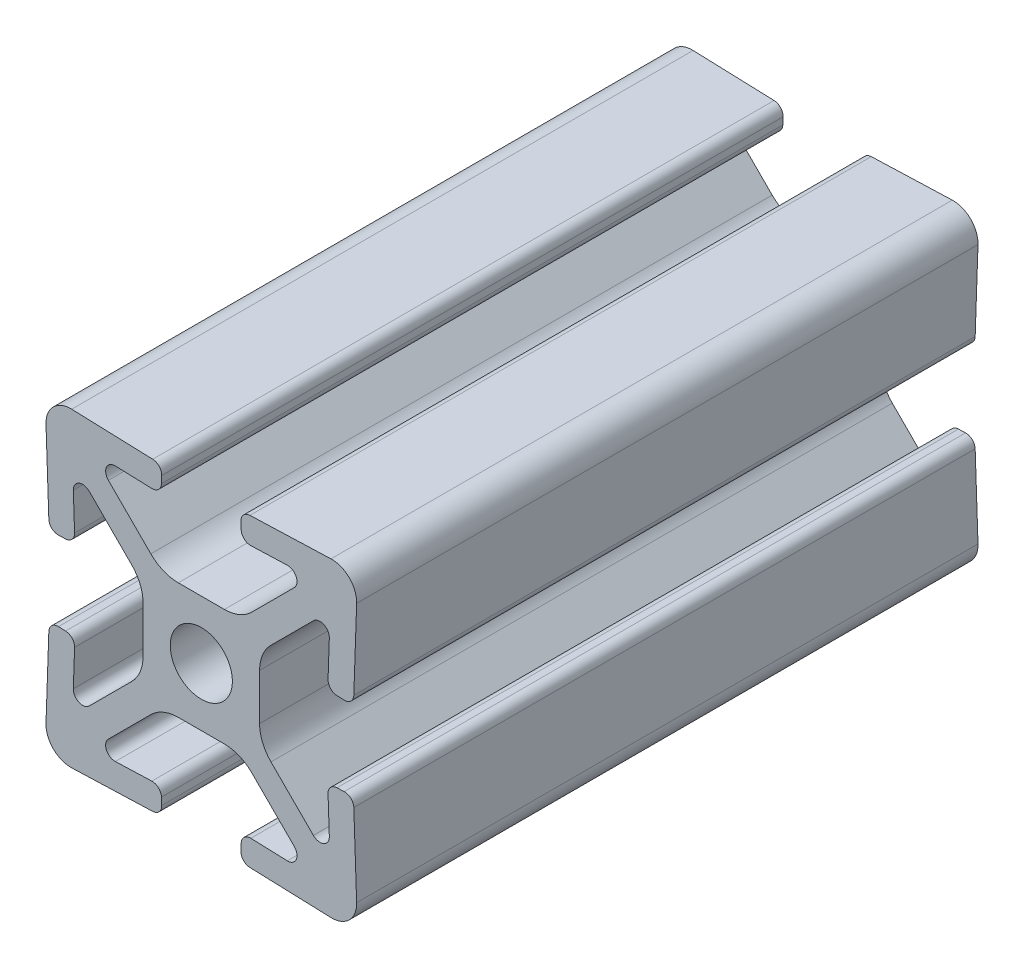
from build123d import *

# Parameters (mm, degrees)
BOSS_EXTRUDE1_DEPTH = 609.6
CIRPATTERN1_COUNT   = 4
CUT_EXTRUDE1_DEPTH  = 1168.4


with BuildPart() as part:
    # Sketch3 → Boss-Extrude1 (new, symmetric)
    with BuildSketch(Plane.XY):
        with BuildLine():
            Line((0, 4.7625), (-1.884807374, 4.7625))
            ThreePointArc((-1.884807374, 4.7625), (-3.099827272, 5.004182484), (-4.129871405, 5.69243597))
            Line((-4.129871405, 5.69243597), (-7.599623114, 9.162187679))
            ThreePointArc((-7.599623114, 9.162187679), (-7.759888701, 10.006330839), (-7.033220609, 10.464824259))
            Line((-7.033220609, 10.464824259), (-4.047481702, 10.360559959))
            ThreePointArc((-4.047481702, 10.360559959), (-3.501205536, 10.564804249), (-3.259352476, 11.095502353))
            Line((-3.259352476, 11.095502353), (-3.23896419, 11.679346474))
            ThreePointArc((-3.23896419, 11.679346474), (-3.443208479, 12.225622641), (-3.973906584, 12.467475701))
            Line((-3.973906584, 12.467475701), (-10.597084223, 12.698762161))
            ThreePointArc((-10.597084223, 12.698762161), (-12.104840979, 12.104840979), (-12.698762161, 10.597084223))
            Line((-12.698762161, 10.597084223), (-12.467475701, 3.973906584))
            ThreePointArc((-12.467475701, 3.973906584), (-12.225622641, 3.443208479), (-11.679346474, 3.23896419))
            Line((-11.679346474, 3.23896419), (-11.095502353, 3.259352476))
            ThreePointArc((-11.095502353, 3.259352476), (-10.564804249, 3.501205536), (-10.360559959, 4.047481702))
            Line((-10.360559959, 4.047481702), (-10.464824259, 7.033220609))
            ThreePointArc((-10.464824259, 7.033220609), (-10.006330839, 7.759888701), (-9.162187679, 7.599623114))
            Line((-9.162187679, 7.599623114), (-5.69243597, 4.129871405))
            ThreePointArc((-5.69243597, 4.129871405), (-5.004182484, 3.099827272), (-4.7625, 1.884807374))
            Line((-4.7625, 1.884807374), (-4.7625, 0))
            Line((-4.7625, 0), (-2.54, 0))
            ThreePointArc((-2.54, 0), (-1.796051224, 1.796051224), (0, 2.54))
            Line((0, 2.54), (0, 4.7625))
        make_face()
    boss_extrude1 = extrude(amount=BOSS_EXTRUDE1_DEPTH, both=True)

    # CirPattern1: Boss-Extrude1 ×4 about axis
    cirpattern1_axis = Axis((0, 0, 0), (0, 0, 1))
    for i in range(1, CIRPATTERN1_COUNT):
        add(boss_extrude1.rotate(cirpattern1_axis, i * 360 / CIRPATTERN1_COUNT))

    # Sketch4 → Cut-Extrude1 (cut)
    with BuildSketch(Plane.XY.offset(609.6)):
        with BuildLine():
            Line((1.884807374, 4.7625), (-1.884807374, 4.7625))
            ThreePointArc((-1.884807374, 4.7625), (-3.099827272, 5.004182484), (-4.129871405, 5.69243597))
            Line((-4.129871405, 5.69243597), (-7.599623114, 9.162187679))
            ThreePointArc((-7.599623114, 9.162187679), (-7.759888701, 10.006330839), (-7.033220609, 10.464824259))
            Line((-7.033220609, 10.464824259), (-4.047481702, 10.360559959))
            ThreePointArc((-4.047481702, 10.360559959), (-3.501205536, 10.564804249), (-3.259352476, 11.095502353))
            Line((-3.259352476, 11.095502353), (-3.23896419, 11.679346474))
            ThreePointArc((-3.23896419, 11.679346474), (-3.443208479, 12.225622641), (-3.973906584, 12.467475701))
            Line((-3.973906584, 12.467475701), (-10.597084223, 12.698762161))
            ThreePointArc((-10.597084223, 12.698762161), (-12.104840979, 12.104840979), (-12.698762161, 10.597084223))
            Line((-12.698762161, 10.597084223), (-12.467475701, 3.973906584))
            ThreePointArc((-12.467475701, 3.973906584), (-12.225622641, 3.443208479), (-11.679346474, 3.23896419))
            Line((-11.679346474, 3.23896419), (-11.095502353, 3.259352476))
            ThreePointArc((-11.095502353, 3.259352476), (-10.564804249, 3.501205536), (-10.360559959, 4.047481702))
            Line((-10.360559959, 4.047481702), (-10.464824259, 7.033220609))
            ThreePointArc((-10.464824259, 7.033220609), (-10.006330839, 7.759888701), (-9.162187679, 7.599623114))
            Line((-9.162187679, 7.599623114), (-5.69243597, 4.129871405))
            ThreePointArc((-5.69243597, 4.129871405), (-5.004182484, 3.099827272), (-4.7625, 1.884807374))
            Line((-4.7625, 1.884807374), (-4.7625, -1.884807374))
            ThreePointArc((-4.7625, -1.884807374), (-5.004182484, -3.099827272), (-5.69243597, -4.129871405))
            Line((-5.69243597, -4.129871405), (-9.162187679, -7.599623114))
            ThreePointArc((-9.162187679, -7.599623114), (-10.006330839, -7.759888701), (-10.464824259, -7.033220609))
            Line((-10.464824259, -7.033220609), (-10.360559959, -4.047481702))
            ThreePointArc((-10.360559959, -4.047481702), (-10.564804249, -3.501205536), (-11.095502353, -3.259352476))
            Line((-11.095502353, -3.259352476), (-11.679346474, -3.23896419))
            ThreePointArc((-11.679346474, -3.23896419), (-12.225622641, -3.443208479), (-12.467475701, -3.973906584))
            Line((-12.467475701, -3.973906584), (-12.698762161, -10.597084223))
            ThreePointArc((-12.698762161, -10.597084223), (-12.104840979, -12.104840979), (-10.597084223, -12.698762161))
            Line((-10.597084223, -12.698762161), (-3.973906584, -12.467475701))
            ThreePointArc((-3.973906584, -12.467475701), (-3.443208479, -12.225622641), (-3.23896419, -11.679346474))
            Line((-3.23896419, -11.679346474), (-3.259352476, -11.095502353))
            ThreePointArc((-3.259352476, -11.095502353), (-3.501205536, -10.564804249), (-4.047481702, -10.360559959))
            Line((-4.047481702, -10.360559959), (-7.033220609, -10.464824259))
            ThreePointArc((-7.033220609, -10.464824259), (-7.759888701, -10.006330839), (-7.599623114, -9.162187679))
            Line((-7.599623114, -9.162187679), (-4.129871405, -5.69243597))
            ThreePointArc((-4.129871405, -5.69243597), (-3.099827272, -5.004182484), (-1.884807374, -4.7625))
            Line((-1.884807374, -4.7625), (1.884807374, -4.7625))
            ThreePointArc((1.884807374, -4.7625), (3.099827272, -5.004182484), (4.129871405, -5.69243597))
            Line((4.129871405, -5.69243597), (7.599623114, -9.162187679))
            ThreePointArc((7.599623114, -9.162187679), (7.759888701, -10.006330839), (7.033220609, -10.464824259))
            Line((7.033220609, -10.464824259), (4.047481702, -10.360559959))
            ThreePointArc((4.047481702, -10.360559959), (3.501205536, -10.564804249), (3.259352476, -11.095502353))
            Line((3.259352476, -11.095502353), (3.23896419, -11.679346474))
            ThreePointArc((3.23896419, -11.679346474), (3.443208479, -12.225622641), (3.973906584, -12.467475701))
            Line((3.973906584, -12.467475701), (10.597084223, -12.698762161))
            ThreePointArc((10.597084223, -12.698762161), (12.104840979, -12.104840979), (12.698762161, -10.597084223))
            Line((12.698762161, -10.597084223), (12.467475701, -3.973906584))
            ThreePointArc((12.467475701, -3.973906584), (12.225622641, -3.443208479), (11.679346474, -3.23896419))
            Line((11.679346474, -3.23896419), (11.095502353, -3.259352476))
            ThreePointArc((11.095502353, -3.259352476), (10.564804249, -3.501205536), (10.360559959, -4.047481702))
            Line((10.360559959, -4.047481702), (10.464824259, -7.033220609))
            ThreePointArc((10.464824259, -7.033220609), (10.006330839, -7.759888701), (9.162187679, -7.599623114))
            Line((9.162187679, -7.599623114), (5.69243597, -4.129871405))
            ThreePointArc((5.69243597, -4.129871405), (5.004182484, -3.099827272), (4.7625, -1.884807374))
            Line((4.7625, -1.884807374), (4.7625, 1.884807374))
            ThreePointArc((4.7625, 1.884807374), (5.004182484, 3.099827272), (5.69243597, 4.129871405))
            Line((5.69243597, 4.129871405), (9.162187679, 7.599623114))
            ThreePointArc((9.162187679, 7.599623114), (10.006330839, 7.759888701), (10.464824259, 7.033220609))
            Line((10.464824259, 7.033220609), (10.360559959, 4.047481702))
            ThreePointArc((10.360559959, 4.047481702), (10.564804249, 3.501205536), (11.095502353, 3.259352476))
            Line((11.095502353, 3.259352476), (11.679346474, 3.23896419))
            ThreePointArc((11.679346474, 3.23896419), (12.225622641, 3.443208479), (12.467475701, 3.973906584))
            Line((12.467475701, 3.973906584), (12.698762161, 10.597084223))
            ThreePointArc((12.698762161, 10.597084223), (12.104840979, 12.104840979), (10.597084223, 12.698762161))
            Line((10.597084223, 12.698762161), (3.973906584, 12.467475701))
            ThreePointArc((3.973906584, 12.467475701), (3.443208479, 12.225622641), (3.23896419, 11.679346474))
            Line((3.23896419, 11.679346474), (3.259352476, 11.095502353))
            ThreePointArc((3.259352476, 11.095502353), (3.501205536, 10.564804249), (4.047481702, 10.360559959))
            Line((4.047481702, 10.360559959), (7.033220609, 10.464824259))
            ThreePointArc((7.033220609, 10.464824259), (7.759888701, 10.006330839), (7.599623114, 9.162187679))
            Line((7.599623114, 9.162187679), (4.129871405, 5.69243597))
            ThreePointArc((4.129871405, 5.69243597), (3.099827272, 5.004182484), (1.884807374, 4.7625))
        make_face()
    extrude(amount=-CUT_EXTRUDE1_DEPTH, mode=Mode.SUBTRACT)


solid = part.part
